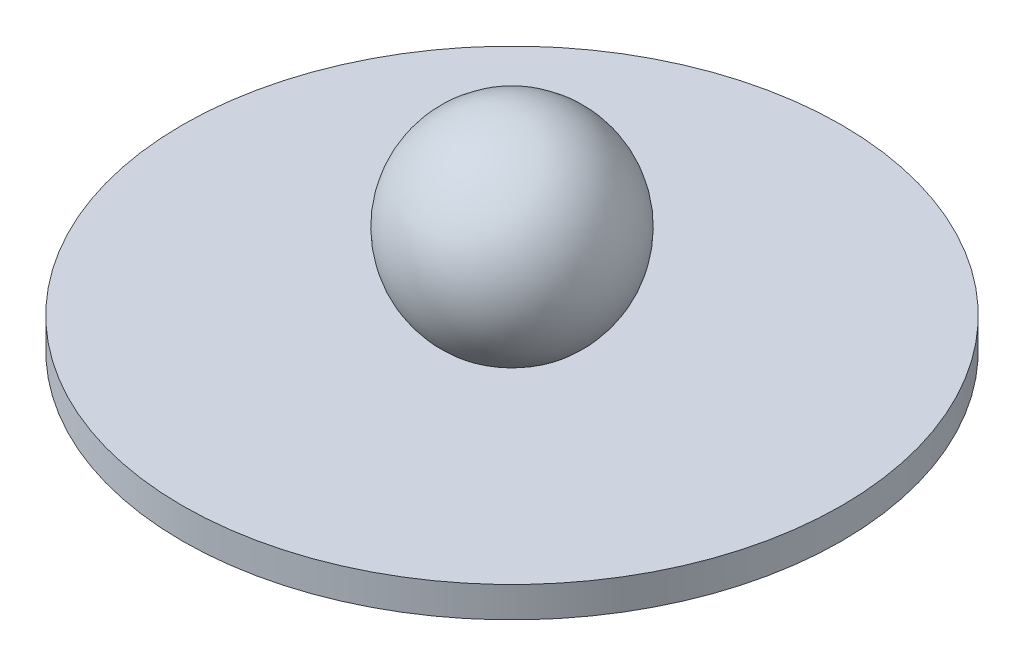
from build123d import *


with BuildPart() as part:
    # Sketch1 → Revolve1 (revolve)
    with BuildSketch(Plane.XY, mode=Mode.PRIVATE) as revolve1_sk:
        Polygon((62.865, 12.7), (62.865, 6.858), (57.785, 6.858), (50.927, 0), (0, 0), (0, 12.7), align=None)
    revolve(revolve1_sk.sketch.rotate(Axis((0, 0, 0), (0, 1, 0)), 90), axis=Axis((0, 0, 0), (0, 1, 0)))

    # Sketch2 → Revolve2 (revolve)
    with BuildSketch(Plane.XY):
        with BuildLine():
            Line((0, 46.314295443), (0, 8.214295443))
            ThreePointArc((0, 8.214295443), (19.05, 27.264295443), (0, 46.314295443))
        make_face()
    revolve(axis=Axis((0, 0, 0), (0, 1, 0)))


solid = part.part
